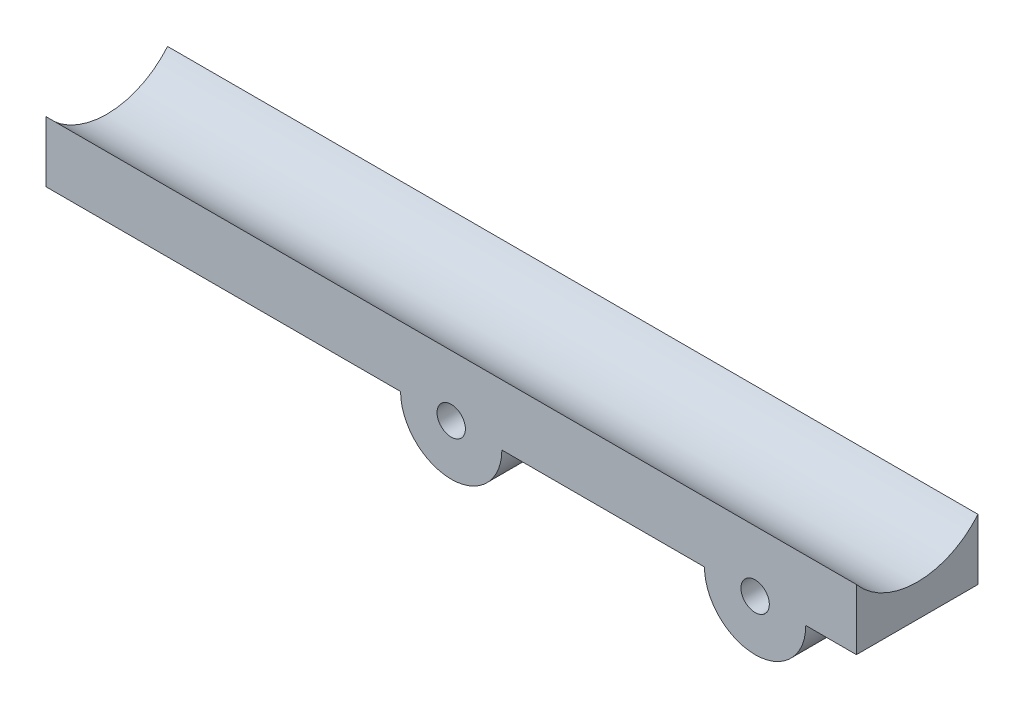
from build123d import *

# Parameters (mm, degrees)
SKETCH1_R           = 12.5
SKETCH1_W           = 200
SKETCH1_H           = 15
BOSS_EXTRUDE1_DEPTH = 30
CUT_EXTRUDE2_REACH  = 204.793
SKETCH2_R           = 3.5
CUT_EXTRUDE3_START  = -27
SKETCH2_3_R         = 8
SKETCH2_3_R_2       = 3.5
CUT_EXTRUDE3_DEPTH  = 3
CUT_EXTRUDE4_REACH  = 204.793


with BuildPart() as part:
    # Sketch1 → Boss-Extrude1 (new body)
    with BuildSketch(Plane.XY):
        with Locations((175, 0)):
            Circle(SKETCH1_R)
        with Locations((100, 0)):
            Circle(SKETCH1_R)
        with Locations((100, 7.5)):
            Rectangle(SKETCH1_W, SKETCH1_H)
        with BuildLine():
            ThreePointArc((187.5, 0), (175, 12.5), (162.5, 0))
            Line((162.5, 0), (175, 0))
            Line((175, 0), (187.5, 0))
        make_face()
        with BuildLine():
            Line((175, 0), (162.5, 0))
            ThreePointArc((162.5, 0), (175, -12.5), (187.5, 0))
            Line((187.5, 0), (175, 0))
        make_face()
        with BuildLine():
            ThreePointArc((187.5, 0), (175, 12.5), (162.5, 0))
            Line((162.5, 0), (175, 0))
            Line((175, 0), (187.5, 0))
        make_face()
        with BuildLine():
            Line((175, 0), (162.5, 0))
            ThreePointArc((162.5, 0), (175, -12.5), (187.5, 0))
            Line((187.5, 0), (175, 0))
        make_face()
        with BuildLine():
            ThreePointArc((112.5, 0), (100, 12.5), (87.5, 0))
            Line((87.5, 0), (100, 0))
            Line((100, 0), (112.5, 0))
        make_face()
        with BuildLine():
            Line((100, 0), (87.5, 0))
            ThreePointArc((87.5, 0), (100, -12.5), (112.5, 0))
            Line((112.5, 0), (100, 0))
        make_face()
        with BuildLine():
            ThreePointArc((112.5, 0), (100, 12.5), (87.5, 0))
            Line((87.5, 0), (100, 0))
            Line((100, 0), (112.5, 0))
        make_face()
        with BuildLine():
            Line((100, 0), (87.5, 0))
            ThreePointArc((87.5, 0), (100, -12.5), (112.5, 0))
            Line((112.5, 0), (100, 0))
        make_face()
    extrude(amount=BOSS_EXTRUDE1_DEPTH)

    # Sketch2 → Cut-Extrude2 (cut, up to next)
    with BuildSketch(Plane.XY.offset(30), mode=Mode.PRIVATE) as cut_extrude2_sk1:
        with Locations((100, 0)):
            Circle(SKETCH2_R)
    cut_extrude2_tool1 = extrude(cut_extrude2_sk1.sketch, amount=-CUT_EXTRUDE2_REACH, mode=Mode.PRIVATE) & part.part
    # Sketch2 → Cut-Extrude2 (cut, up to next)
    with BuildSketch(Plane.XY.offset(30), mode=Mode.PRIVATE) as cut_extrude2_sk2:
        with Locations((175, 0)):
            Circle(SKETCH2_R)
    cut_extrude2_tool2 = extrude(cut_extrude2_sk2.sketch, amount=-CUT_EXTRUDE2_REACH, mode=Mode.PRIVATE) & part.part
    add(cut_extrude2_tool1.solids().sort_by_distance((100, 0, 30))[0], mode=Mode.SUBTRACT)
    add(cut_extrude2_tool2.solids().sort_by_distance((175, 0, 30))[0], mode=Mode.SUBTRACT)

    # Sketch2<3> → Cut-Extrude3 (cut)
    # profile 1 of 2: a face of its own
    with BuildSketch(Plane.XY.offset(30).offset(CUT_EXTRUDE3_START)):
        with Locations((100, 0)):
            Circle(SKETCH2_3_R)
        with Locations((100, 0)):
            Circle(SKETCH2_3_R_2, mode=Mode.SUBTRACT)
    # profile 2 of 2: a face of its own
    with BuildSketch(Plane.XY.offset(30).offset(CUT_EXTRUDE3_START)):
        with Locations((175, 0)):
            Circle(SKETCH2_3_R)
        with Locations((175, 0)):
            Circle(SKETCH2_3_R_2, mode=Mode.SUBTRACT)
    extrude(amount=-CUT_EXTRUDE3_DEPTH, mode=Mode.SUBTRACT)

    # Sketch3 → Cut-Extrude4 (cut, up to next)
    with BuildSketch(Plane.ZY, mode=Mode.PRIVATE) as cut_extrude4_sk1:
        with BuildLine():
            Line((0, 15), (30, 15))
            ThreePointArc((30, 15), (15, 8), (0, 15))
        make_face()
    cut_extrude4_tool1 = extrude(cut_extrude4_sk1.sketch, amount=-CUT_EXTRUDE4_REACH, mode=Mode.PRIVATE) & part.part
    add(cut_extrude4_tool1.solids().sort_by_distance((0, 12.152086, 15))[0], mode=Mode.SUBTRACT)


solid = part.part
